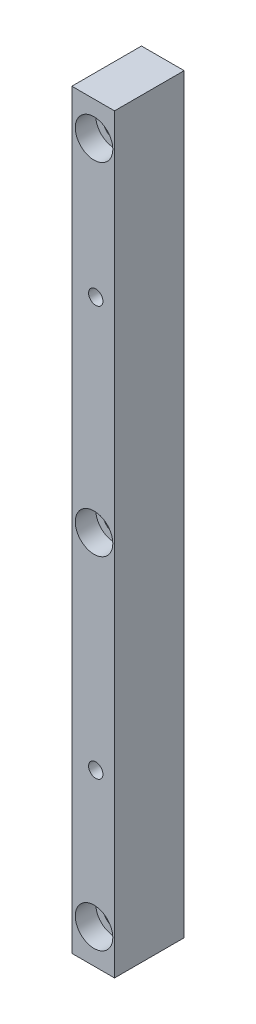
from build123d import *

# Parameters (mm, degrees)
ESBO_O1_W                         = 12.5
ESBO_O1_H                         = 220
RESSALTO_EXTRUS_O1_DEPTH          = 20.4
REBAIXO_PARA_SHCS_M61_D           = 6.6
REBAIXO_PARA_SHCS_M61_CBORE_D     = 11
REBAIXO_PARA_SHCS_M61_CBORE_DEPTH = 6
FURO_ROSCADO_DE_M5X0_81_D         = 4.2


with BuildPart() as part:
    # Esboço1 → Ressalto-extrusão1 (new body)
    with BuildSketch(Plane.XY):
        with Locations((-110.75, 0)):
            Rectangle(ESBO_O1_W, ESBO_O1_H)
    extrude(amount=RESSALTO_EXTRUS_O1_DEPTH)

    # Rebaixo para SHCS M61 (through all)
    with Locations(Plane.XY.offset(20.4)):
        with Locations((-110.5, 100), (-110.5, 0), (-110.5, -100)):
            CounterBoreHole(REBAIXO_PARA_SHCS_M61_D / 2, REBAIXO_PARA_SHCS_M61_CBORE_D / 2, REBAIXO_PARA_SHCS_M61_CBORE_DEPTH)

    # Furo roscado de M5x0.81 (through all)
    with Locations(Plane.XY.offset(20.4)):
        with Locations((-110, 60), (-110, -60)):
            Hole(FURO_ROSCADO_DE_M5X0_81_D / 2)


solid = part.part
